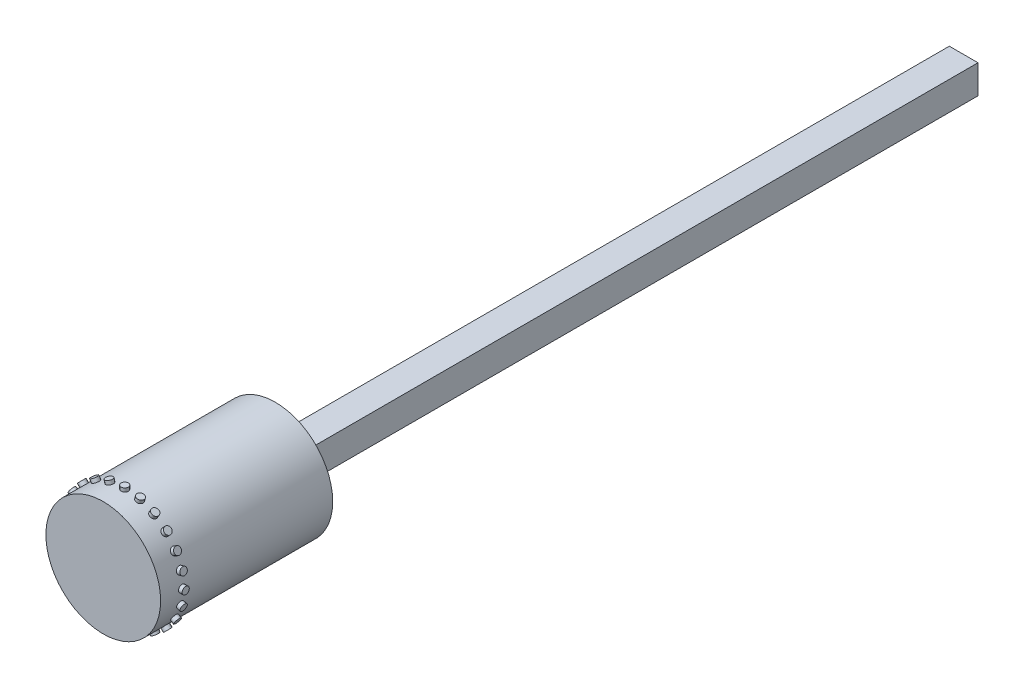
from build123d import *

# Parameters (mm, degrees)
SKETCH1_R           = 50.8
BOSS_EXTRUDE1_DEPTH = 152.4
SKETCH2_W           = 25.4
SKETCH2_H           = 25.4
BOSS_EXTRUDE2_DEPTH = 609.6
SKETCH3_R           = 3.175
BOSS_EXTRUDE3_DEPTH = 53.975
CIRPATTERN1_COUNT   = 24


with BuildPart() as part:
    # Sketch1 → Boss-Extrude1 (new body)
    with BuildSketch(Plane.XY):
        with Locations(Location((0, 0, 0), (0, 0, 180))):
            Circle(SKETCH1_R)
    extrude(amount=BOSS_EXTRUDE1_DEPTH)

    # Sketch2 → Boss-Extrude2 (add)
    with BuildSketch(Plane(origin=(0, 0, 0), x_dir=(-1, 0, 0), z_dir=(0, 0, -1))):
        Rectangle(SKETCH2_W, SKETCH2_H)
    extrude(amount=BOSS_EXTRUDE2_DEPTH)

    # Sketch3 → Boss-Extrude3 (add)
    with BuildSketch(Plane(origin=(0, 0, 0), x_dir=(1, 0, 0), z_dir=(0, 1, 0))):
        with Locations(Location((0, -133.35, 0), (0, 0, 90))):
            Circle(SKETCH3_R)
    boss_extrude3 = extrude(amount=BOSS_EXTRUDE3_DEPTH)

    # CirPattern1: Boss-Extrude3 ×24 about axis
    cirpattern1_axis = Axis((0, 0, 0), (0, 0, 1))
    for i in range(1, CIRPATTERN1_COUNT):
        add(boss_extrude3.rotate(cirpattern1_axis, i * 360 / CIRPATTERN1_COUNT))


solid = part.part
